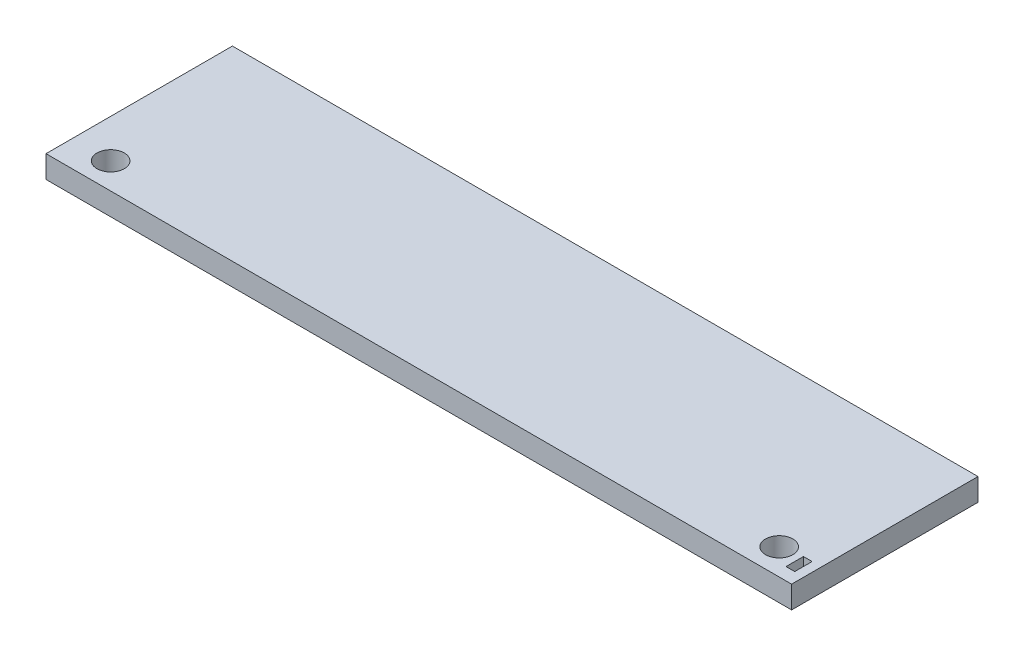
from build123d import *

# Parameters (mm, degrees)
ESQUISSE1_W             = 600
ESQUISSE1_H             = 150
BOSS_EXTRU_1_DEPTH      = 18
ESQUISSE3_R             = 11
ENL_V_MAT_EXTRU_1_DEPTH = 20
ESQUISSE4_W             = 7
ESQUISSE4_H             = 14
ENL_V_MAT_EXTRU_2_DEPTH = 12


with BuildPart() as part:
    # Esquisse1 → Boss.-Extru.1 (new body)
    with BuildSketch(Plane(origin=(0, 0, 0), x_dir=(1, 0, 0), z_dir=(0, 1, 0))):
        Rectangle(ESQUISSE1_W, ESQUISSE1_H)
    extrude(amount=BOSS_EXTRU_1_DEPTH)

    # Esquisse3 → Enlèv. mat.-Extru.1 (cut)
    with BuildSketch(Plane(origin=(0, 18, 0), x_dir=(1, 0, 0), z_dir=(0, 1, 0))):
        with Locations(Location((269, -54, 0), (0, 0, 270))):
            Circle(ESQUISSE3_R)
        with Locations(Location((-269, -54, 0), (0, 0, 270))):
            Circle(ESQUISSE3_R)
    extrude(amount=-ENL_V_MAT_EXTRU_1_DEPTH, mode=Mode.SUBTRACT)

    # Esquisse4 → Enlèv. mat.-Extru.2 (cut)
    with BuildSketch(Plane(origin=(0, 18, 0), x_dir=(1, 0, 0), z_dir=(0, 1, 0))):
        with Locations((289, -58)):
            Rectangle(ESQUISSE4_W, ESQUISSE4_H)
    extrude(amount=-ENL_V_MAT_EXTRU_2_DEPTH, mode=Mode.SUBTRACT)


solid = part.part
